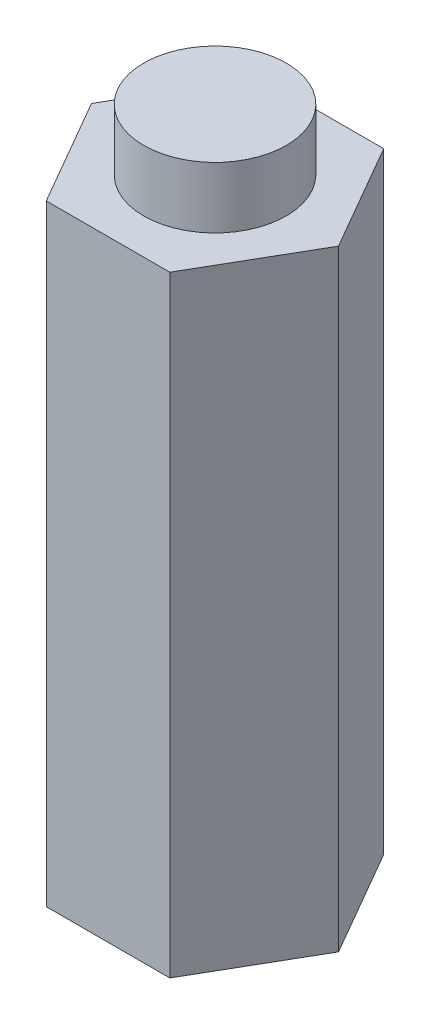
from build123d import *

# Parameters (mm, degrees)
BOSS_EXTRUDE1_DEPTH = 60
SKETCH1_3_R         = 7
BOSS_EXTRUDE2_DEPTH = 66


with BuildPart() as part:
    # Sketch1 → Boss-Extrude1 (new body)
    with BuildSketch(Plane(origin=(0, 0, 0), x_dir=(1, 0, 0), z_dir=(0, 1, 0))):
        Polygon((6.062177826, -10.5), (12.124355653, 0), (6.062177826, 10.5), (-6.062177826, 10.5), (-12.124355653, 0), (-6.062177826, -10.5), align=None)
    extrude(amount=BOSS_EXTRUDE1_DEPTH)

    # Sketch1<3> → Boss-Extrude2 (add)
    with BuildSketch(Plane(origin=(0, 0, 0), x_dir=(1, 0, 0), z_dir=(0, 1, 0))):
        Circle(SKETCH1_3_R)
    extrude(amount=BOSS_EXTRUDE2_DEPTH)


solid = part.part
